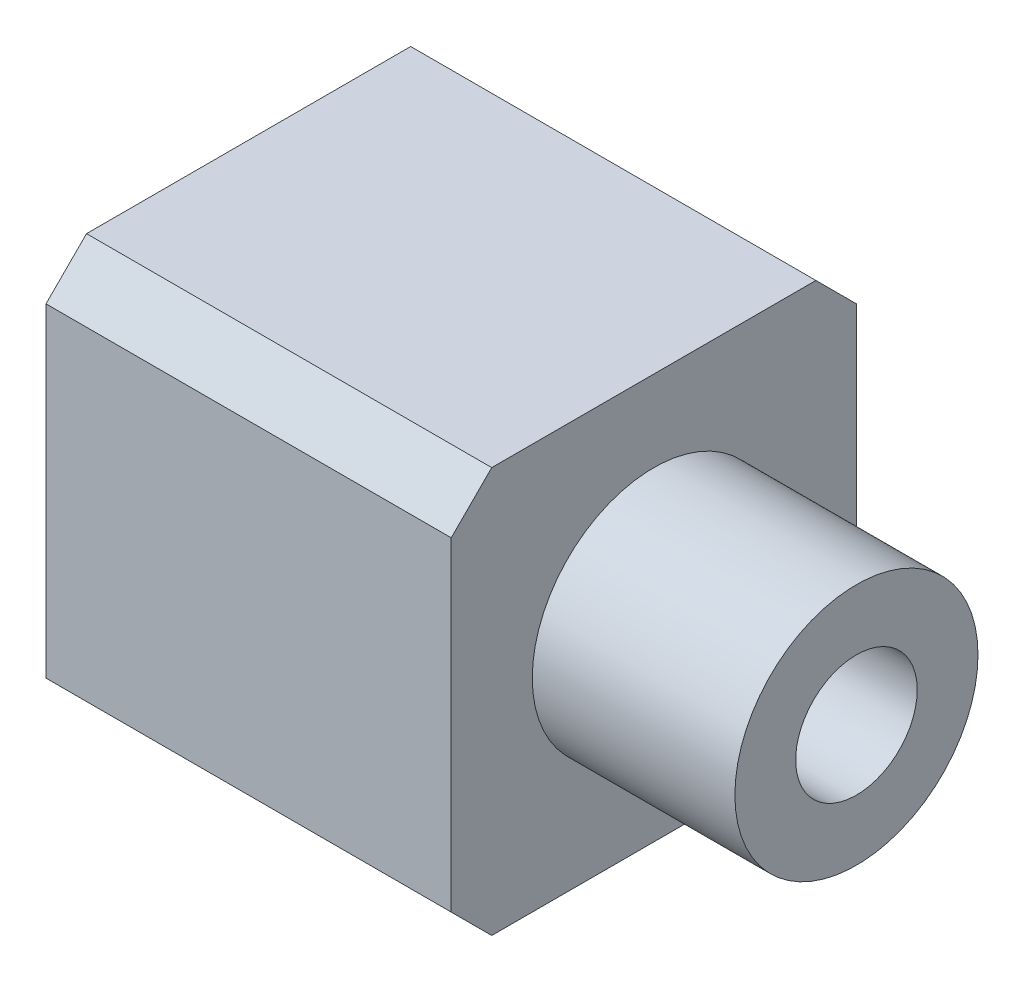
from build123d import *

# Parameters (mm, degrees)
SKETCH1_W           = 10
SKETCH1_H           = 10
BOSS_EXTRUDE1_DEPTH = 17
SKETCH2_R           = 15.353568197
SKETCH2_R_2         = 3
CUT_EXTRUDE1_DEPTH  = 5
CUT_EXTRUDE2_START  = -2
SKETCH3_R           = 15.635411304
SKETCH3_R_2         = 3
CUT_EXTRUDE2_DEPTH  = 2
SKETCH4_R           = 1.5
CUT_EXTRUDE3_DEPTH  = 19.41195264
CHAMFER1_SIZE       = 1
CUT_EXTRUDE4_START  = 5
SKETCH5_R           = 1.5
CUT_EXTRUDE4_DEPTH  = 2


with BuildPart() as part:
    # Sketch1 → Boss-Extrude1 (new body)
    with BuildSketch(Plane(origin=(0, 0, 0), x_dir=(0, 0, -1), z_dir=(1, 0, 0))):
        Rectangle(SKETCH1_W, SKETCH1_H)
    extrude(amount=-BOSS_EXTRUDE1_DEPTH)

    # Sketch2 → Cut-Extrude1 (cut)
    with BuildSketch(Plane(origin=(0, 0, 0), x_dir=(0, 0, -1), z_dir=(1, 0, 0))):
        Circle(SKETCH2_R)
        Circle(SKETCH2_R_2, mode=Mode.SUBTRACT)
    extrude(amount=-CUT_EXTRUDE1_DEPTH, mode=Mode.SUBTRACT)

    # Sketch3 → Cut-Extrude2 (cut)
    with BuildSketch(Plane.ZY.offset(17).offset(CUT_EXTRUDE2_START)):
        Circle(SKETCH3_R)
        with Locations(Location((0, 0, 0), (0, 0, 180))):
            Circle(SKETCH3_R_2, mode=Mode.SUBTRACT)
    extrude(amount=CUT_EXTRUDE2_DEPTH, mode=Mode.SUBTRACT)

    # Sketch4 → Cut-Extrude3 (cut, through all)
    with BuildSketch(Plane(origin=(0, 0, 0), x_dir=(0, 0, -1), z_dir=(1, 0, 0))):
        Circle(SKETCH4_R)
    extrude(amount=-CUT_EXTRUDE3_DEPTH, mode=Mode.SUBTRACT)

    # Chamfer1
    chamfer1_edges = [part.edges().sort_by_distance(p)[0] for p in [
        (-10, -5, -5),
        (-10, -5, 5),
        (-10, 5, -5),
        (-10, 5, 5),
    ]]
    chamfer(chamfer1_edges, length=CHAMFER1_SIZE)

    # Sketch5 → Cut-Extrude4 (cut)
    with BuildSketch(Plane(origin=(0, 0, 0), x_dir=(-1, 0, 0), z_dir=(0, 0, -1)).offset(CUT_EXTRUDE4_START)):
        with Locations((10, 0)):
            Circle(SKETCH5_R)
    extrude(amount=-CUT_EXTRUDE4_DEPTH, mode=Mode.SUBTRACT)


solid = part.part
